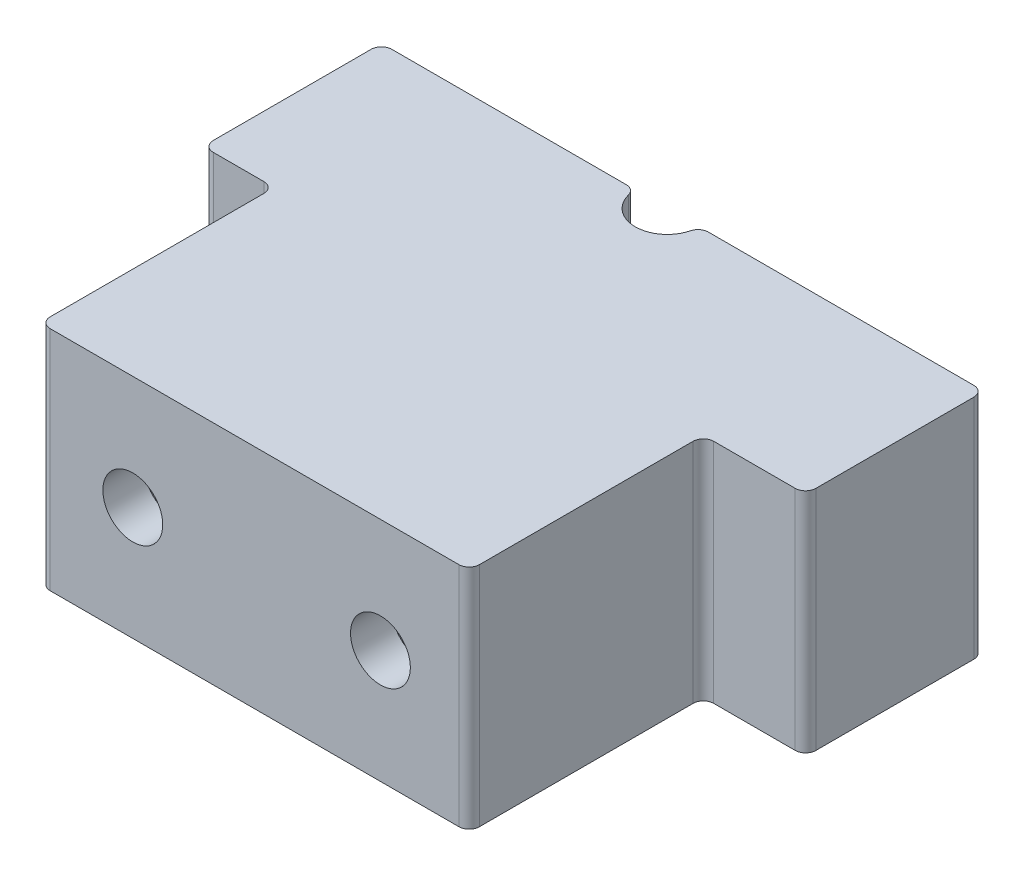
from build123d import *

# Parameters (mm, degrees)
BOSS_EXTRUDE1_DEPTH = 11
SKETCH2_R           = 1.45
CUT_EXTRUDE1_DEPTH  = 8
SKETCH3_R           = 1.5
CUT_EXTRUDE2_DEPTH  = 10
CUT_EXTRUDE4_START  = -2
CUT_EXTRUDE4_DEPTH  = 2.4
SKETCH1_4_W         = 4.95
SKETCH1_4_H         = 8.65
SKETCH1_4_W_2       = 3.45
BOSS_EXTRUDE2_DEPTH = 11
CUT_EXTRUDE3_START  = -2
SKETCH5_R           = 1.5
CUT_EXTRUDE3_DEPTH  = 2.4
FILLET2_R           = 0.5


with BuildPart() as part:
    # Sketch1 → Boss-Extrude1 (new body)
    with BuildSketch(Plane(origin=(0, 0, 0), x_dir=(1, 0, 0), z_dir=(0, 1, 0))):
        with BuildLine():
            ThreePointArc((-1.55, 10), (0, 8.45), (1.55, 10))
            Line((1.55, 10), (10.4, 10))
            Line((10.4, 10), (10.4, -10))
            Line((10.4, -10), (-10.4, -10))
            Line((-10.4, -10), (-10.4, 10))
            Line((-10.4, 10), (-1.55, 10))
        make_face()
    extrude(amount=BOSS_EXTRUDE1_DEPTH)

    # Sketch2 → Cut-Extrude1 (cut)
    with BuildSketch(Plane.XY.offset(10)):
        with Locations((-5.9, 5.5)):
            Circle(SKETCH2_R)
        with Locations((6.1, 5.5)):
            Circle(SKETCH2_R)
    extrude(amount=-CUT_EXTRUDE1_DEPTH, mode=Mode.SUBTRACT)

    # Sketch3 → Cut-Extrude2 (cut)
    with BuildSketch(Plane(origin=(0, 0, -10), x_dir=(-1, 0, 0), z_dir=(0, 0, -1))):
        with Locations((-8.1, 5.5)):
            Circle(SKETCH3_R)
        with Locations((8.1, 5.5)):
            Circle(SKETCH3_R)
    extrude(amount=-CUT_EXTRUDE2_DEPTH, mode=Mode.SUBTRACT)

    # Sketch6 → Cut-Extrude4 (cut)
    with BuildSketch(Plane.XY.offset(10).offset(CUT_EXTRUDE4_START)):
        Polygon((-5.9, 8.559956427), (-8.55, 7.029978213), (-8.55, 3.970021787), (-8.55, 0), (-3.25, 0), (-3.25, 3.970021787), (-3.25, 7.029978213), align=None)
        Polygon((6.1, 8.559956427), (3.45, 7.029978213), (3.45, 3.970021787), (3.45, 0), (8.75, 0), (8.75, 3.970021787), (8.75, 7.029978213), align=None)
    extrude(amount=-CUT_EXTRUDE4_DEPTH, mode=Mode.SUBTRACT)

    # Sketch1<4> → Boss-Extrude2 (add, through all)
    with BuildSketch(Plane(origin=(0, 0, 0), x_dir=(1, 0, 0), z_dir=(0, 1, 0))):
        with Locations((12.875, 5.675)):
            Rectangle(SKETCH1_4_W, SKETCH1_4_H)
        with Locations((-12.125, 5.675)):
            Rectangle(SKETCH1_4_W_2, SKETCH1_4_H)
    extrude(amount=BOSS_EXTRUDE2_DEPTH)

    # Sketch5 → Cut-Extrude3 (cut)
    # profile 1 of 2: a face of its own
    with BuildSketch(Plane(origin=(0, 0, -10), x_dir=(-1, 0, 0), z_dir=(0, 0, -1)).offset(CUT_EXTRUDE3_START)):
        Polygon((-5.475, 0), (-5.475, 3.984455543), (-5.475, 7.015544457), (-8.1, 8.531088913), (-10.725, 7.015544457), (-10.725, 3.984455543), (-10.725, 0), align=None)
        with Locations((-8.1, 5.5)):
            Circle(SKETCH5_R, mode=Mode.SUBTRACT)
    # profile 2 of 2: a face of its own
    with BuildSketch(Plane(origin=(0, 0, -10), x_dir=(-1, 0, 0), z_dir=(0, 0, -1)).offset(CUT_EXTRUDE3_START)):
        Polygon((5.475, 0), (10.725, 0), (10.725, 3.984455543), (10.725, 7.015544457), (8.1, 8.531088913), (5.475, 7.015544457), (5.475, 3.984455543), align=None)
    extrude(amount=-CUT_EXTRUDE3_DEPTH, mode=Mode.SUBTRACT)

    # Fillet2
    fillet2_edges = [part.edges().sort_by_distance(p)[0] for p in [
        (1.55, 5.5, -10),
        (10.4, 5.5, 10),
        (-10.4, 5.5, 10),
        (-1.55, 5.5, -10),
        (10.4, 5.5, -1.35),
        (15.35, 5.5, -1.35),
        (15.35, 5.5, -10),
        (-13.85, 5.5, -10),
        (-13.85, 5.5, -1.35),
        (-10.4, 5.5, -1.35),
    ]]
    fillet(fillet2_edges, radius=FILLET2_R)


solid = part.part
